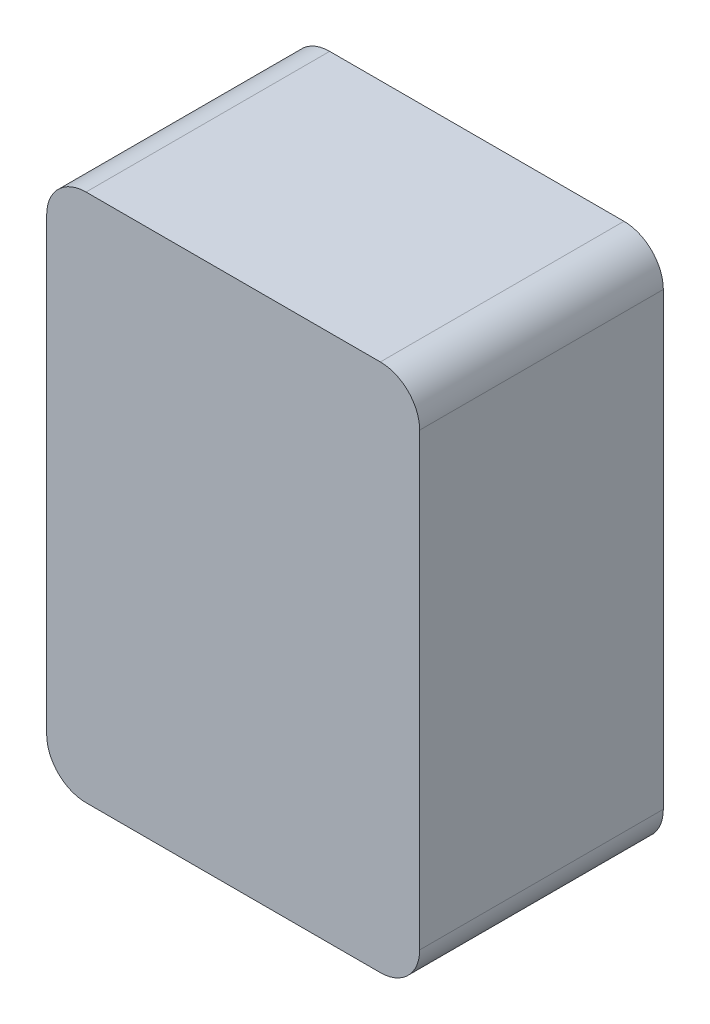
from build123d import *

# Parameters (mm, degrees)
BOSS_EXTRUDE1_DEPTH = 65
CUT_EXTRUDE1_DEPTH  = 64.5


with BuildPart() as part:
    # Sketch1 → Boss-Extrude1 (new body)
    with BuildSketch(Plane.XY):
        with BuildLine():
            Line((-41.858898811, 77.335550487), (36.658112947, 77.335550487))
            ThreePointArc((36.658112947, 77.335550487), (44.082734149, 74.26017169), (47.158112947, 66.835550487))
            Line((47.158112947, 66.835550487), (47.158112947, -53.267111925))
            ThreePointArc((47.158112947, -53.267111925), (44.082734149, -60.691733127), (36.658112947, -63.767111925))
            Line((36.658112947, -63.767111925), (-41.858898811, -63.767111925))
            ThreePointArc((-41.858898811, -63.767111925), (-49.283520014, -60.691733127), (-52.358898811, -53.267111925))
            Line((-52.358898811, -53.267111925), (-52.358898811, 66.835550487))
            ThreePointArc((-52.358898811, 66.835550487), (-49.283520014, 74.26017169), (-41.858898811, 77.335550487))
        make_face()
    extrude(amount=BOSS_EXTRUDE1_DEPTH)

    # Sketch1<4> → Cut-Extrude1 (cut)
    with BuildSketch(Plane.XY):
        with BuildLine():
            Line((36.658112947, 76.835550487), (-41.858898811, 76.835550487))
            ThreePointArc((-41.858898811, 76.835550487), (-48.929966623, 73.906618299), (-51.858898811, 66.835550487))
            Line((-51.858898811, 66.835550487), (-51.858898811, -53.267111925))
            ThreePointArc((-51.858898811, -53.267111925), (-48.929966623, -60.338179736), (-41.858898811, -63.267111925))
            Line((-41.858898811, -63.267111925), (36.658112947, -63.267111925))
            ThreePointArc((36.658112947, -63.267111925), (43.729180759, -60.338179736), (46.658112947, -53.267111925))
            Line((46.658112947, -53.267111925), (46.658112947, 66.835550487))
            ThreePointArc((46.658112947, 66.835550487), (43.729180759, 73.906618299), (36.658112947, 76.835550487))
        make_face()
    extrude(amount=CUT_EXTRUDE1_DEPTH, mode=Mode.SUBTRACT)


solid = part.part
